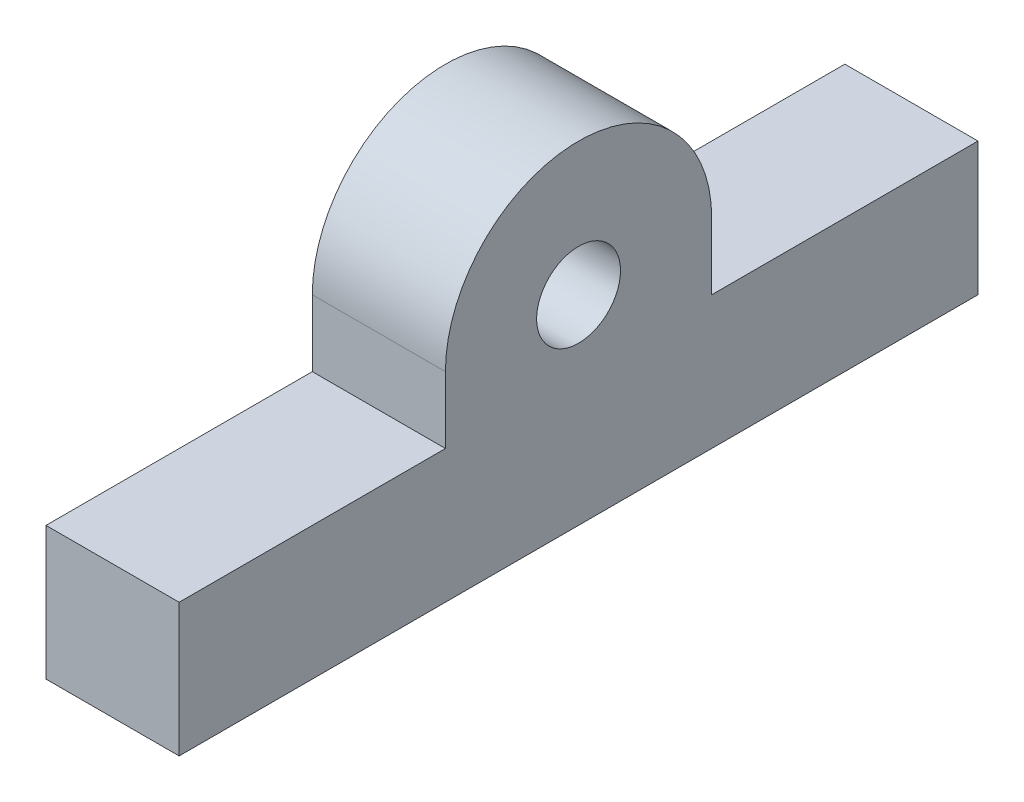
from build123d import *

# Parameters (mm, degrees)
BOSS_EXTRUDE1_DEPTH = 12.7
SKETCH2_R           = 4
CUT_EXTRUDE1_DEPTH  = 84.521209881
SKETCH3_R           = 1.27
CUT_EXTRUDE2_DEPTH  = 6.35


with BuildPart() as part:
    # Sketch1 → Boss-Extrude1 (new body)
    with BuildSketch(Plane(origin=(0, 0, 0), x_dir=(0, 0, -1), z_dir=(1, 0, 0))):
        with BuildLine():
            Line((0, 0), (76.2, 0))
            Line((76.2, 0), (76.2, 12.7))
            Line((76.2, 12.7), (50.8, 12.7))
            Line((50.8, 12.7), (50.8, 19.05))
            ThreePointArc((50.8, 19.05), (38.1, 31.75), (25.4, 19.05))
            Line((25.4, 19.05), (25.4, 12.7))
            Line((25.4, 12.7), (0, 12.7))
            Line((0, 12.7), (0, 0))
        make_face()
    extrude(amount=BOSS_EXTRUDE1_DEPTH)

    # Sketch2 → Cut-Extrude1 (cut, through all)
    with BuildSketch(Plane(origin=(12.7, 0, 0), x_dir=(0, 0, -1), z_dir=(1, 0, 0))):
        with Locations((38.1, 19.05)):
            Circle(SKETCH2_R)
    extrude(amount=-CUT_EXTRUDE1_DEPTH, mode=Mode.SUBTRACT)

    # Sketch3 → Cut-Extrude2 (cut)
    with BuildSketch(Plane.XZ):
        with Locations(Location((6.35, -12.7, 0), (0, 0, 270))):
            Circle(SKETCH3_R)
        with Locations(Location((6.35, -63.5, 0), (0, 0, 270))):
            Circle(SKETCH3_R)
    extrude(amount=-CUT_EXTRUDE2_DEPTH, mode=Mode.SUBTRACT)


solid = part.part
